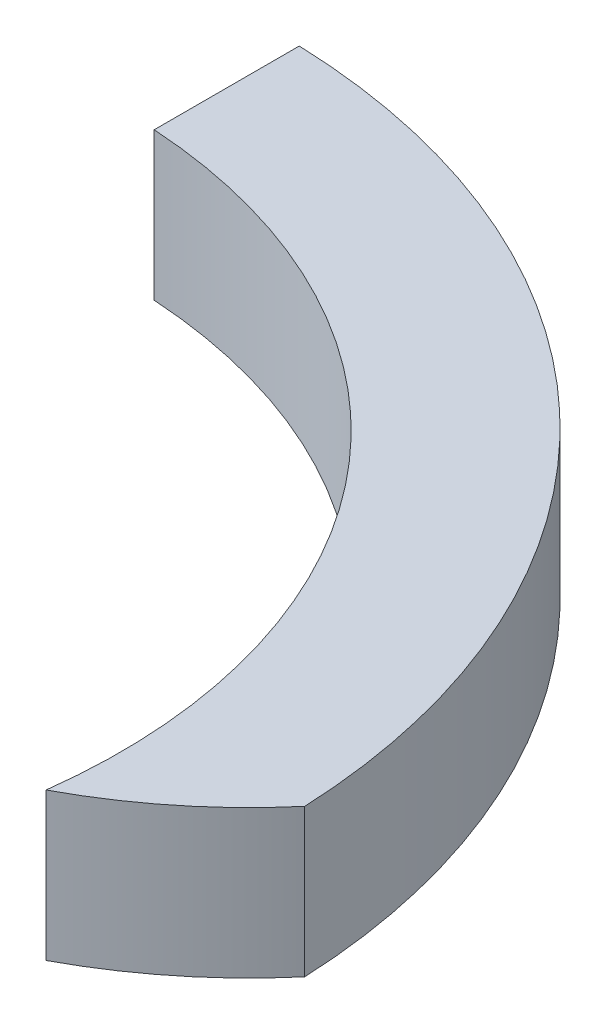
from build123d import *

# Parameters (mm, degrees)
BOSS_EXTRUDE1_DEPTH     = 25.4
BOSS_EXTRUDE1_2_DEPTH   = 25.4
CUT_EXTRUDE1_DEPTH      = 281.867791968
CUT_EXTRUDE1_DEPTH_BACK = 281.867791968
SKETCH2_W               = 46.910236734
SKETCH2_H               = 46.937556504
CUT_EXTRUDE2_DEPTH      = 281.278275978
CUT_EXTRUDE2_DEPTH_BACK = 281.278275978
SKETCH3_OUTSIDE_W       = 231.024
SKETCH3_OUTSIDE_H       = 277.081


with BuildPart() as part:
    # Sketch1 → Boss-Extrude1 (new body)
    with BuildSketch(Plane(origin=(0, 0, 0), x_dir=(1, 0, 0), z_dir=(0, 1, 0))):
        with BuildLine():
            Line((0, 80.02759766), (0, 219.067642019))
            Line((0, 219.067642019), (103.040086398, 219.067642019))
            Line((103.040086398, 219.067642019), (103.040086398, 195.999460881))
            Line((103.040086398, 195.999460881), (23.011829096, 195.999460881))
            Line((23.011829096, 195.999460881), (23.011829096, 161.013213822))
            ThreePointArc((23.011829096, 161.013213822), (101.985495584, 126.901824422), (136.744902109, 48.211224327))
            ThreePointArc((136.744902109, 48.211224327), (146.280346481, 62.911008862), (150.026111113, 80.02759766))
            Line((150.026111113, 80.02759766), (150.026111113, 148.011746996))
            Line((150.026111113, 148.011746996), (172.974333949, 148.011746996))
            Line((172.974333949, 148.011746996), (172.974333949, 80.02759766))
            ThreePointArc((172.974333949, 80.02759766), (86.487166974, 0.037389651), (0, 80.02759766))
        make_face()
        with BuildLine():
            Line((23.011829096, 136.058182002), (23.011829096, 80.02759766))
            ThreePointArc((23.011829096, 80.02759766), (54.48283159, 31.69310754), (112.066438029, 28.410547154))
            ThreePointArc((112.066438029, 28.410547154), (90.841729512, 101.512108787), (23.011829096, 136.058182002))
        make_face(mode=Mode.SUBTRACT)
    extrude(amount=BOSS_EXTRUDE1_DEPTH)

    # Sketch3 outside → Cut-Extrude2 (cut, two sides: drawn at the far end of the back side and taken through both)
    with BuildSketch(Plane(origin=(0, 25.4, 0), x_dir=(1, 0, 0), z_dir=(0, 1, 0)).offset(-CUT_EXTRUDE2_DEPTH_BACK)):
        with Locations((86.487, 109.5525)):
            Rectangle(SKETCH3_OUTSIDE_W, SKETCH3_OUTSIDE_H)
        with BuildLine():
            Line((23.011829096, 161.013213822), (23.011829096, 136.058182002))
            ThreePointArc((23.011829096, 136.058182002), (90.841729512, 101.512108787), (112.066438029, 28.410547154))
            ThreePointArc((112.066438029, 28.410547154), (125.345033884, 37.140114864), (136.744902109, 48.211224327))
            ThreePointArc((136.744902109, 48.211224327), (101.985495584, 126.901824422), (23.011829096, 161.013213822))
        make_face(mode=Mode.SUBTRACT)
    extrude(amount=CUT_EXTRUDE2_DEPTH + CUT_EXTRUDE2_DEPTH_BACK, mode=Mode.SUBTRACT)


with BuildPart() as body_2:
    # Sketch1 → Boss-Extrude1 2 (new body)
    with BuildSketch(Plane(origin=(0, 0, 0), x_dir=(1, 0, 0), z_dir=(0, 1, 0))):
        Polygon((173.927929859, 172.130085515), (150.026111113, 172.130085515), (150.026111113, 195.999460881), (127.017693125, 195.999460881), (127.017693125, 219.067642019), (173.927929859, 219.067642019), align=None)
    extrude(amount=BOSS_EXTRUDE1_2_DEPTH)

    # Sketch2 → Cut-Extrude1 (cut, two sides: drawn at the far end of the back side and taken through both)
    with BuildSketch(Plane(origin=(0, 25.4, 0), x_dir=(1, 0, 0), z_dir=(0, 1, 0)).offset(-CUT_EXTRUDE1_DEPTH_BACK)):
        with Locations((150.472811492, 195.598863767)):
            Rectangle(SKETCH2_W, SKETCH2_H)
    extrude(amount=CUT_EXTRUDE1_DEPTH + CUT_EXTRUDE1_DEPTH_BACK, mode=Mode.SUBTRACT)


solid = part.part
